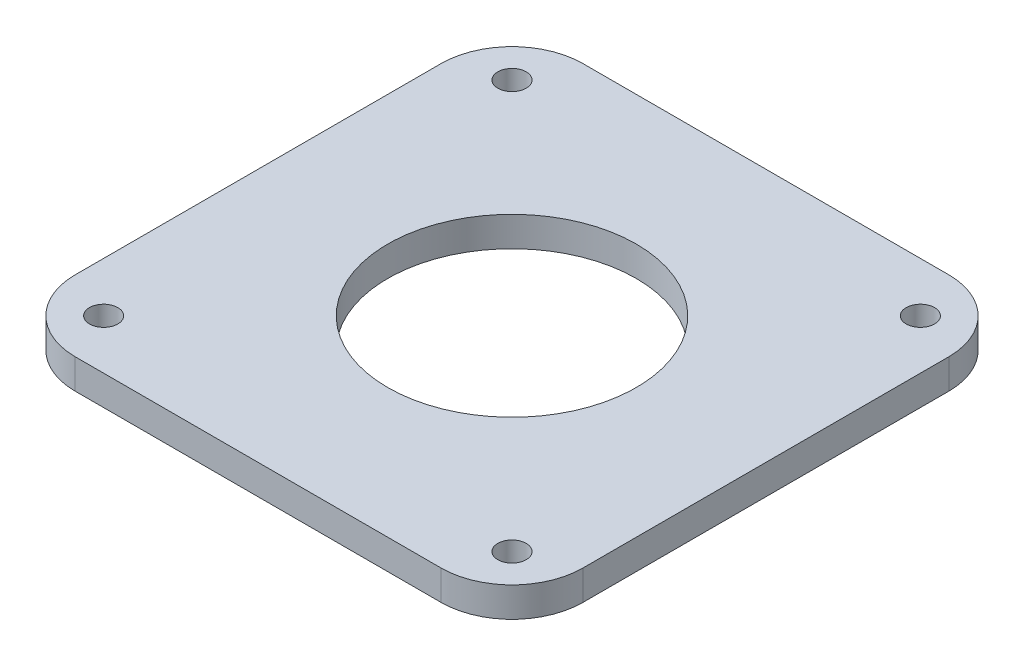
from build123d import *

# Parameters (mm, degrees)
SKETCH1_W           = 71.5
SKETCH1_H           = 71.5
BOSS_EXTRUDE1_DEPTH = 4.2
FILLET1_R           = 10
SKETCH2_R           = 17.5
CUT_EXTRUDE1_DEPTH  = 51.732287549
SKETCH3_R           = 2
CUT_EXTRUDE2_DEPTH  = 51.732287549


with BuildPart() as part:
    # Sketch1 → Boss-Extrude1 (new body)
    with BuildSketch(Plane(origin=(0, 0, 0), x_dir=(1, 0, 0), z_dir=(0, 1, 0))):
        Rectangle(SKETCH1_W, SKETCH1_H)
    extrude(amount=BOSS_EXTRUDE1_DEPTH)

    # Fillet1
    fillet1_edges = [part.edges().sort_by_distance(p)[0] for p in [
        (35.75, 2.1, 35.75),
        (-35.75, 2.1, 35.75),
        (-35.75, 2.1, -35.75),
        (35.75, 2.1, -35.75),
    ]]
    fillet(fillet1_edges, radius=FILLET1_R)

    # Sketch2 → Cut-Extrude1 (cut, through all)
    with BuildSketch(Plane(origin=(0, 4.2, 0), x_dir=(1, 0, 0), z_dir=(0, 1, 0))):
        with Locations(Location((0, 0, 0), (0, 0, 270))):
            Circle(SKETCH2_R)
    extrude(amount=-CUT_EXTRUDE1_DEPTH, mode=Mode.SUBTRACT)

    # Sketch3 → Cut-Extrude2 (cut, through all)
    with BuildSketch(Plane(origin=(0, 4.2, 0), x_dir=(1, 0, 0), z_dir=(0, 1, 0))):
        with Locations(Location((-28.75, 28.75, 0), (0, 0, 270))):
            Circle(SKETCH3_R)
        with Locations(Location((28.75, 28.75, 0), (0, 0, 270))):
            Circle(SKETCH3_R)
        with Locations(Location((-28.75, -28.75, 0), (0, 0, 270))):
            Circle(SKETCH3_R)
        with Locations(Location((28.75, -28.75, 0), (0, 0, 270))):
            Circle(SKETCH3_R)
    extrude(amount=-CUT_EXTRUDE2_DEPTH, mode=Mode.SUBTRACT)


solid = part.part
